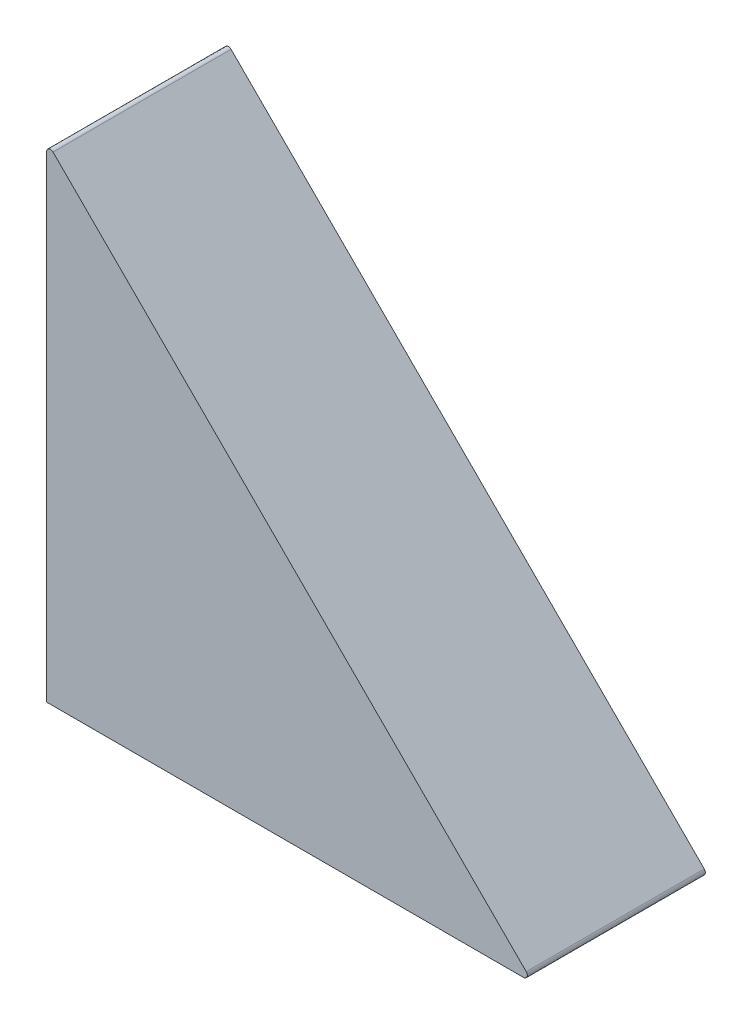
from build123d import *

# Parameters (mm, degrees)
BOSS_EXTRUDE1_DEPTH = 4.7625


with BuildPart() as part:
    # Sketch1 → Boss-Extrude1 (new body)
    with BuildSketch(Plane.XY):
        with BuildLine():
            Line((0, 0), (12.758578644, 0))
            ThreePointArc((12.758578644, 0), (12.850966597, 0.061731657), (12.829289322, 0.170710678))
            Line((12.829289322, 0.170710678), (0.170710678, 12.829289322))
            ThreePointArc((0.170710678, 12.829289322), (0.061731657, 12.850966597), (0, 12.758578644))
            Line((0, 12.758578644), (0, 0))
        make_face()
    extrude(amount=BOSS_EXTRUDE1_DEPTH)


solid = part.part
